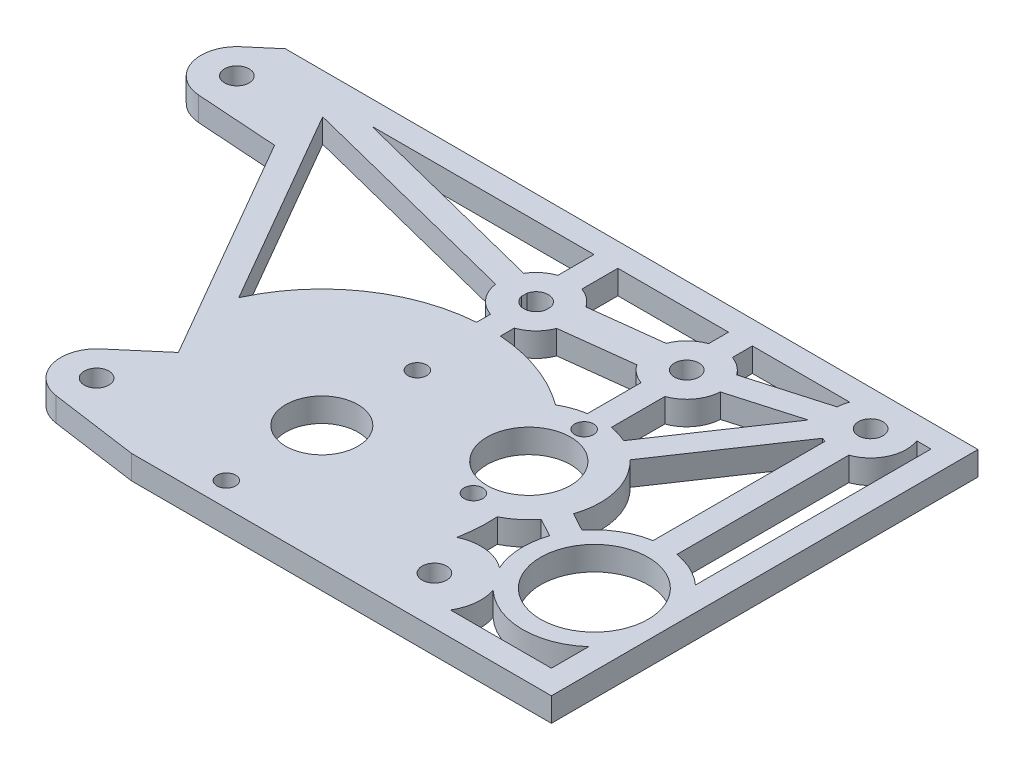
from build123d import *

# Parameters (mm, degrees)
SKETCH2_R           = 9.6012
SKETCH2_R_2         = 2.4892
SKETCH2_R_3         = 3.2639
SKETCH2_R_4         = 11.1252
SKETCH2_R_5         = 14.3002
SKETCH2_R_6         = 2.413
BOSS_EXTRUDE1_DEPTH = 6.35
SKETCH3_R           = 3.2639
SKETCH3_R_2         = 2.413
SKETCH3_R_3         = 2.4892
CUT_EXTRUDE1_DEPTH  = 177.630627937


with BuildPart() as part:
    # Sketch2 → Boss-Extrude1 (new body)
    with BuildSketch(Plane(origin=(0, 0, 0), x_dir=(1, 0, 0), z_dir=(0, 1, 0))):
        Polygon((-155.087712155, 84.29625), (-89.463193808, -29.36875), (82.46904885, -29.36875), (82.46904885, 84.29625), align=None)
        with Locations(Location((-41.275, 2.38125, 0), (0, 0, 270))):
            Circle(SKETCH2_R, mode=Mode.SUBTRACT)
        with Locations(Location((-41.275, 27.78125, 0), (0, 0, 270))):
            Circle(SKETCH2_R_2, mode=Mode.SUBTRACT)
        with Locations(Location((-41.275, -23.01875, 0), (0, 0, 270))):
            Circle(SKETCH2_R_2, mode=Mode.SUBTRACT)
        with Locations(Location((-82.130845389, -16.66875, 0), (0, 0, 270))):
            Circle(SKETCH2_R_3, mode=Mode.SUBTRACT)
        with Locations(Location((-133.090666899, 71.59625, 0), (0, 0, 270))):
            Circle(SKETCH2_R_3, mode=Mode.SUBTRACT)
        with Locations(Location((-5.496024757, 21.654924548, 0), (0, 0, 270))):
            Circle(SKETCH2_R_4, mode=Mode.SUBTRACT)
        with Locations(Location((32.48383617, 1.11125, 0), (0, 0, 270))):
            Circle(SKETCH2_R_5, mode=Mode.SUBTRACT)
        with Locations(Location((61.774869917, 67.406835627, 0), (0, 0, 270))):
            Circle(SKETCH2_R_6, mode=Mode.SUBTRACT)
        with Locations(Location((76.11904885, -23.01875, 0), (0, 0, 270))):
            Circle(SKETCH2_R_3, mode=Mode.SUBTRACT)
    extrude(amount=BOSS_EXTRUDE1_DEPTH)

    # Sketch3 → Cut-Extrude1 (cut, through all)
    # profile 1 of 18: a face of its own
    with BuildSketch(Plane(origin=(0, 6.35, 0), x_dir=(1, 0, 0), z_dir=(0, 1, 0))):
        with BuildLine():
            Line((-50.704696238, 58.032833483), (-112.240521983, 73.58273966))
            Line((-112.240521983, 73.58273966), (-81.745655831, 20.764082115))
            ThreePointArc((-81.745655831, 20.764082115), (-66.664634619, 38.866438144), (-44.45, 46.717712139))
            Line((-44.45, 46.717712139), (-44.45, 50.396621207))
            ThreePointArc((-44.45, 50.396621207), (-48.64368552, 53.341307868), (-50.704696238, 58.032833483))
        make_face()
    # profile 2 of 18: a face of its own
    with BuildSketch(Plane(origin=(0, 6.35, 0), x_dir=(1, 0, 0), z_dir=(0, 1, 0))):
        with BuildLine():
            Line((-38.1, 50.396621207), (-38.1, 46.717712139))
            ThreePointArc((-38.1, 46.717712139), (-25.920369141, 44.095010454), (-14.947020834, 38.195213939))
            ThreePointArc((-14.947020834, 38.195213939), (-11.907888955, 39.593444485), (-8.671024757, 40.438477859))
            Line((-8.671024757, 40.438477859), (-8.671024757, 54.678493879))
            ThreePointArc((-8.671024757, 54.678493879), (-11.283169826, 56.093396277), (-13.332375749, 58.244211411))
            Line((-13.332375749, 58.244211411), (-32.382270315, 55.964402602))
            ThreePointArc((-32.382270315, 55.964402602), (-34.629883571, 52.552798441), (-38.1, 50.396621207))
        make_face()
    # profile 3 of 18: a face of its own
    with BuildSketch(Plane(origin=(0, 6.35, 0), x_dir=(1, 0, 0), z_dir=(0, 1, 0))):
        with BuildLine():
            ThreePointArc((-133.733764479, 62.092984745), (-142.13305739, 68.602790594), (-139.277335877, 78.838539138))
            Line((-139.277335877, 78.838539138), (-132.888385663, 84.29625))
            Line((-132.888385663, 84.29625), (-155.087712155, 84.29625))
            Line((-155.087712155, 84.29625), (-89.463193808, -29.36875))
            Line((-89.463193808, -29.36875), (-60.133800133, -29.36875))
            Line((-60.133800133, -29.36875), (-83.452466562, -26.101615019))
            ThreePointArc((-83.452466562, -26.101615019), (-91.274629988, -19.336488408), (-88.317514367, -9.426460862))
            Line((-88.317514367, -9.426460862), (-77.153529536, 0.110286058))
            Line((-77.153529536, 0.110286058), (-112.093783272, 60.628580757))
            Line((-112.093783272, 60.628580757), (-133.733764479, 62.092984745))
        make_face()
    # profile 4 of 18: a face of its own
    with BuildSketch(Plane(origin=(0, 6.35, 0), x_dir=(1, 0, 0), z_dir=(0, 1, 0))):
        Polygon((82.46904885, 84.29625), (-132.888385663, 84.29625), (51.53383617, 84.100664467), (51.53383617, -29.36875), (82.46904885, -29.36875), align=None)
        with Locations((76.11904885, -23.01875)):
            Circle(SKETCH3_R, mode=Mode.SUBTRACT)
        with Locations((61.774869917, 67.406835627)):
            Circle(SKETCH3_R_2, mode=Mode.SUBTRACT)
    # profile 5 of 18: a face of its own
    with BuildSketch(Plane(origin=(0, 6.35, 0), x_dir=(1, 0, 0), z_dir=(0, 1, 0))):
        with BuildLine():
            Line((45.18383617, 15.310281657), (45.18383617, 77.94625))
            Line((45.18383617, 77.94625), (41.398231111, 77.94625))
            ThreePointArc((41.398231111, 77.94625), (41.117229303, 70.57627228), (35.65883617, 65.616284578))
            Line((35.65883617, 65.616284578), (35.65883617, 19.894803311))
            ThreePointArc((35.65883617, 19.894803311), (40.745698306, 18.276451253), (45.18383617, 15.310281657))
        make_face()
    # profile 6 of 18: a face of its own
    with BuildSketch(Plane(origin=(0, 6.35, 0), x_dir=(1, 0, 0), z_dir=(0, 1, 0))):
        with BuildLine():
            Line((-44.45, 77.94625), (-103.5894656, 77.94625))
            Line((-103.5894656, 77.94625), (-49.449869194, 64.2653473))
            ThreePointArc((-49.449869194, 64.2653473), (-47.307458964, 66.748109508), (-44.45, 68.357133449))
            Line((-44.45, 68.357133449), (-44.45, 77.94625))
        make_face()
    # profile 7 of 18: a face of its own
    with BuildSketch(Plane(origin=(0, 6.35, 0), x_dir=(1, 0, 0), z_dir=(0, 1, 0))):
        with BuildLine():
            Line((-8.671024757, 77.94625), (-38.1, 77.94625))
            Line((-38.1, 77.94625), (-38.1, 68.357133449))
            ThreePointArc((-38.1, 68.357133449), (-35.487854931, 66.942231051), (-33.438649008, 64.791415916))
            Line((-33.438649008, 64.791415916), (-14.388754442, 67.071224726))
            ThreePointArc((-14.388754442, 67.071224726), (-12.141141186, 70.482828886), (-8.671024757, 72.639006121))
            Line((-8.671024757, 72.639006121), (-8.671024757, 77.94625))
        make_face()
    # profile 8 of 18: a face of its own
    with BuildSketch(Plane(origin=(0, 6.35, 0), x_dir=(1, 0, 0), z_dir=(0, 1, 0))):
        with BuildLine():
            Line((-2.321024757, 54.678493879), (-2.321024757, 40.438477859))
            ThreePointArc((-2.321024757, 40.438477859), (0.074866406, 39.872160113), (2.377715421, 39.001587501))
            Line((2.377715421, 39.001587501), (22.15801549, 68.318685604))
            Line((22.15801549, 68.318685604), (4.01215469, 63.092933247))
            ThreePointArc((4.01215469, 63.092933247), (2.114261551, 57.93082129), (-2.321024757, 54.678493879))
        make_face()
    # profile 9 of 18: a face of its own
    with BuildSketch(Plane(origin=(0, 6.35, 0), x_dir=(1, 0, 0), z_dir=(0, 1, 0))):
        with BuildLine():
            ThreePointArc((7.641632189, 35.450013166), (13.004757083, 26.196242782), (12.536001856, 15.510942435))
            Line((12.536001856, 15.510942435), (17.472938166, 12.840505779))
            ThreePointArc((17.472938166, 12.840505779), (22.730759734, 17.475234846), (29.30883617, 19.894803311))
            Line((29.30883617, 19.894803311), (29.30883617, 65.614932157))
            ThreePointArc((29.30883617, 65.614932157), (28.790391012, 65.815305481), (28.284516096, 66.045577972))
            Line((28.284516096, 66.045577972), (7.641632189, 35.450013166))
        make_face()
    # profile 10 of 18: a face of its own
    with BuildSketch(Plane(origin=(0, 6.35, 0), x_dir=(1, 0, 0), z_dir=(0, 1, 0))):
        with BuildLine():
            Line((14.451809556, 7.255232113), (9.514873246, 9.925668769))
            ThreePointArc((9.514873246, 9.925668769), (6.605195221, 6.942243792), (3.116401587, 4.662908409))
            ThreePointArc((3.116401587, 4.662908409), (3.08719182, -0.411318161), (2.479854635, -5.449152025))
            ThreePointArc((2.479854635, -5.449152025), (8.985543719, -4.351211356), (15.13161349, -6.750230017))
            ThreePointArc((15.13161349, -6.750230017), (13.456237349, 0.187679153), (14.451809556, 7.255232113))
        make_face()
    # profile 11 of 18: a face of its own
    with BuildSketch(Plane(origin=(0, 6.35, 0), x_dir=(1, 0, 0), z_dir=(0, 1, 0))):
        with BuildLine():
            ThreePointArc((-38.1, 60.133460575), (-41.275, 62.640777328), (-44.45, 60.133460575))
            Line((-44.45, 60.133460575), (-44.45, 58.62029408))
            ThreePointArc((-44.45, 58.62029408), (-41.275, 56.112977328), (-38.1, 58.62029408))
            Line((-38.1, 58.62029408), (-38.1, 60.133460575))
        make_face()
    # profile 12 of 18: a face of its own
    with BuildSketch(Plane(origin=(0, 6.35, 0), x_dir=(1, 0, 0), z_dir=(0, 1, 0))):
        with BuildLine():
            ThreePointArc((-2.321024757, 72.639006121), (0.231903953, 71.269036308), (2.254864024, 69.194935338))
            Line((2.254864024, 69.194935338), (22.97374411, 75.161681012))
            ThreePointArc((22.97374411, 75.161681012), (23.165063227, 76.576202255), (23.565616004, 77.94625))
            Line((23.565616004, 77.94625), (-2.321024757, 77.94625))
            Line((-2.321024757, 77.94625), (-2.321024757, 72.639006121))
        make_face()
    # profile 13 of 18: a face of its own
    with BuildSketch(Plane(origin=(0, 6.35, 0), x_dir=(1, 0, 0), z_dir=(0, 1, 0))):
        with BuildLine():
            Line((18.349161012, -23.01875), (45.18383617, -23.01875))
            Line((45.18383617, -23.01875), (45.18383617, -13.087781657))
            ThreePointArc((45.18383617, -13.087781657), (32.282698959, -17.937688128), (19.486846811, -12.816447857))
            ThreePointArc((19.486846811, -12.816447857), (20.025058188, -18.04104949), (18.349161012, -23.01875))
        make_face()
    # profile 14 of 18: a face of its own
    with BuildSketch(Plane(origin=(0, 6.35, 0), x_dir=(1, 0, 0), z_dir=(0, 1, 0))):
        with Locations(Location((32.481923558, 74.59586426, 0), (0, 0, 270))):
            Circle(SKETCH3_R)
    # profile 15 of 18: a face of its own
    with BuildSketch(Plane(origin=(0, 6.35, 0), x_dir=(1, 0, 0), z_dir=(0, 1, 0))):
        with Locations(Location((-5.496024757, 63.65875, 0), (0, 0, 270))):
            Circle(SKETCH3_R)
    # profile 16 of 18: a face of its own
    with BuildSketch(Plane(origin=(0, 6.35, 0), x_dir=(1, 0, 0), z_dir=(0, 1, 0))):
        with Locations(Location((7.71883617, -16.66875, 0), (0, 0, 270))):
            Circle(SKETCH3_R)
    # profile 17 of 18: a face of its own
    with BuildSketch(Plane(origin=(0, 6.35, 0), x_dir=(1, 0, 0), z_dir=(0, 1, 0))):
        with Locations(Location((-5.496024757, 36.386924548, 0), (0, 0, 270))):
            Circle(SKETCH3_R_3)
    # profile 18 of 18: a face of its own
    with BuildSketch(Plane(origin=(0, 6.35, 0), x_dir=(1, 0, 0), z_dir=(0, 1, 0))):
        with Locations(Location((-5.496024757, 6.922924548, 0), (0, 0, 270))):
            Circle(SKETCH3_R_3)
    extrude(amount=-CUT_EXTRUDE1_DEPTH, mode=Mode.SUBTRACT)


solid = part.part
